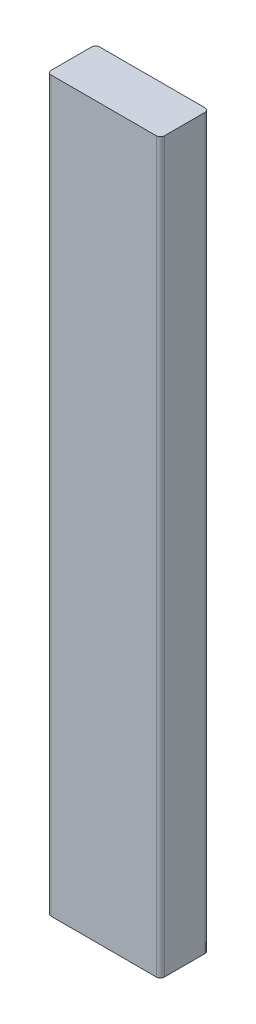
from build123d import *

# Parameters (mm, degrees)
SKETCH1_W           = 88.9
SKETCH1_H           = 38.1
BOSS_EXTRUDE1_DEPTH = 571.5
FILLET1_R           = 3.175


with BuildPart() as part:
    # Sketch1 → Boss-Extrude1 (new body)
    with BuildSketch(Plane(origin=(0, 0, 0), x_dir=(1, 0, 0), z_dir=(0, 1, 0))):
        Rectangle(SKETCH1_W, SKETCH1_H)
    extrude(amount=BOSS_EXTRUDE1_DEPTH)

    # Fillet1
    fillet1_edges = [part.edges().sort_by_distance(p)[0] for p in [
        (44.45, 285.75, 19.05),
        (-44.45, 285.75, 19.05),
        (-44.45, 285.75, -19.05),
        (44.45, 285.75, -19.05),
    ]]
    fillet(fillet1_edges, radius=FILLET1_R)


solid = part.part
